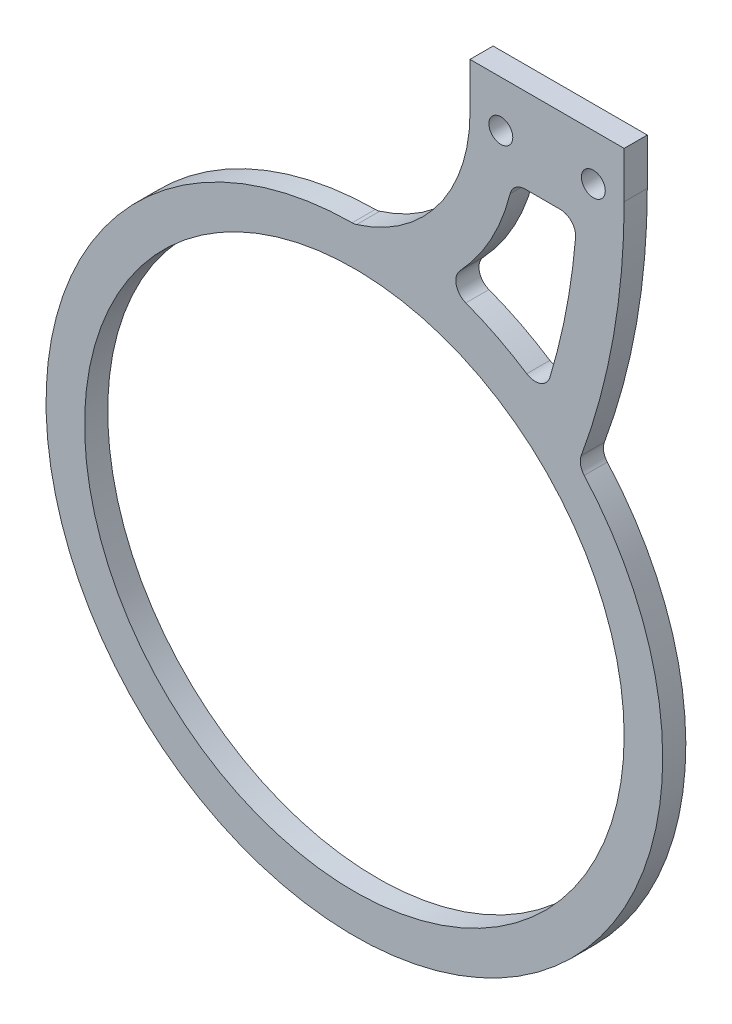
from build123d import *

# Parameters (mm, degrees)
SKETCH_1_R      = 1.55
SKETCH_1_R_2    = 35
EXTRUDE_1_DEPTH = 3
FILLET_1_R      = 2


with BuildPart() as part:
    # 草图1 → 凸台-拉伸1 (new body)
    with BuildSketch(Plane.XY):
        with BuildLine():
            Line((-4, 0), (-4, 6))
            Line((-4, 6), (16, 6))
            Line((16, 6), (16, 0))
            ThreePointArc((16, 0), (14.487394132, -16.500041247), (10, -32.450045372))
            ThreePointArc((10, -32.450045372), (-34.779762591, -96.755939555), (-19, -20))
            ThreePointArc((-19, -20), (-8.166666667, -12.5), (-4, 0))
        make_face()
        Circle(SKETCH_1_R, mode=Mode.SUBTRACT)
        with Locations((12, 0)):
            Circle(SKETCH_1_R, mode=Mode.SUBTRACT)
        with Locations((-19, -60)):
            Circle(SKETCH_1_R_2, mode=Mode.SUBTRACT)
        with BuildLine():
            Line((1.53004615, -5), (9.8523796, -5))
            ThreePointArc((9.8523796, -5), (8.433483023, -16.219496713), (5.533456158, -27.150197429))
            ThreePointArc((5.533456158, -27.150197429), (-0.758932149, -23.281293002), (-7.64339635, -20.60421909))
            ThreePointArc((-7.64339635, -20.60421909), (-1.701196442, -13.598971308), (1.53004615, -5))
        make_face(mode=Mode.SUBTRACT)
    extrude(amount=EXTRUDE_1_DEPTH)

    # 圆角1
    fillet_1_edges = [part.edges().sort_by_distance(p)[0] for p in [
        (-19, -20, 1.5),
        (10, -32.450045372, 1.5),
        (-7.64339635, -20.60421909, 1.5),
        (5.533456158, -27.150197429, 1.5),
        (9.8523796, -5, 1.5),
        (1.53004615, -5, 1.5),
    ]]
    fillet(fillet_1_edges, radius=FILLET_1_R)


solid = part.part
